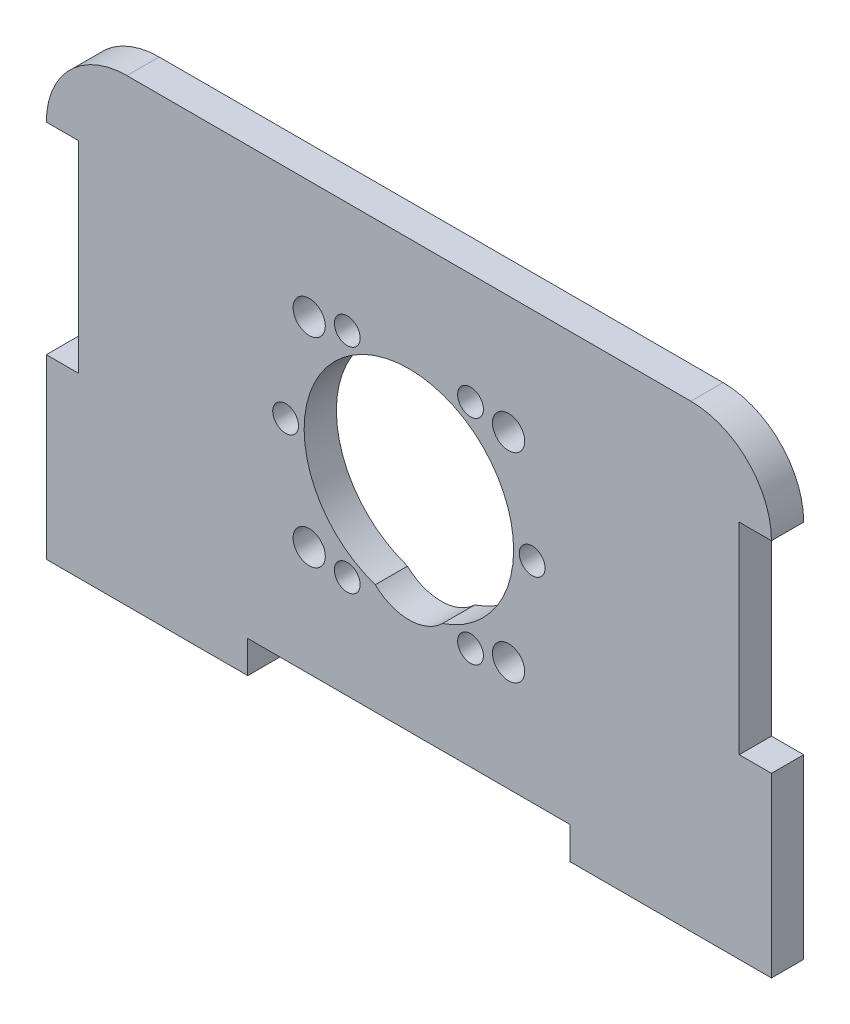
from build123d import *

# Parameters (mm, degrees)
SKETCH1_W           = 50
SKETCH1_H           = 4
BOSS_EXTRUDE1_DEPTH = 50
SKETCH2_R           = 13
CUT_EXTRUDE1_DEPTH  = 50
SKETCH4_R           = 2
CUT_EXTRUDE3_DEPTH  = 50
SKETCH7_W           = 4
SKETCH7_H           = 50
BOSS_EXTRUDE3_DEPTH = 20
SKETCH8_W           = 90
SKETCH8_H           = 4
BOSS_EXTRUDE4_DEPTH = 3
SKETCH9_W           = 25
SKETCH9_H           = 4
BOSS_EXTRUDE5_DEPTH = 4
FILLET1_R           = 10
SKETCH10_R          = 1.6
CUT_EXTRUDE4_DEPTH  = 20
CIRPATTERN1_COUNT   = 6
SKETCH11_R          = 6
CUT_EXTRUDE5_DEPTH  = 20
SKETCH12_W          = 4
SKETCH12_H          = 25
CUT_EXTRUDE6_DEPTH  = 20


with BuildPart() as part:
    # Sketch1 → Boss-Extrude1 (new body)
    with BuildSketch(Plane(origin=(0, 0, 0), x_dir=(1, 0, 0), z_dir=(0, 1, 0))):
        Rectangle(SKETCH1_W, SKETCH1_H)
    extrude(amount=BOSS_EXTRUDE1_DEPTH)

    # Sketch2 → Cut-Extrude1 (cut)
    with BuildSketch(Plane.XY.offset(2)):
        with Locations((0, 23)):
            Circle(SKETCH2_R)
    extrude(amount=-CUT_EXTRUDE1_DEPTH, mode=Mode.SUBTRACT)

    # Sketch4 → Cut-Extrude3 (cut)
    with BuildSketch(Plane.XY.offset(2)):
        with Locations((12.374368671, 35.374368671)):
            Circle(SKETCH4_R)
        with Locations((12.374368671, 10.625631329)):
            Circle(SKETCH4_R)
        with Locations((-12.374368671, 35.374368671)):
            Circle(SKETCH4_R)
        with Locations((-12.374368671, 10.625631329)):
            Circle(SKETCH4_R)
    extrude(amount=-CUT_EXTRUDE3_DEPTH, mode=Mode.SUBTRACT)

    # Sketch7 → Boss-Extrude3 (add)
    with BuildSketch(Plane.ZY.offset(25)):
        with Locations((0, 25)):
            Rectangle(SKETCH7_W, SKETCH7_H)
    boss_extrude3 = extrude(amount=BOSS_EXTRUDE3_DEPTH)

    # Mirror1: Boss-Extrude3 across plane
    add(boss_extrude3.mirror(Plane(origin=(0, 0, 0), x_dir=(0, 0, 1), z_dir=(1, 0, 0))))

    # Sketch8 → Boss-Extrude4 (add)
    with BuildSketch(Plane.XZ):
        Rectangle(SKETCH8_W, SKETCH8_H)
    extrude(amount=BOSS_EXTRUDE4_DEPTH)

    # Sketch9 → Boss-Extrude5 (add)
    with BuildSketch(Plane.XY.offset(2)):
        with Locations((-32.5, -5)):
            Rectangle(SKETCH9_W, SKETCH9_H)
        with Locations((32.5, -5)):
            Rectangle(SKETCH9_W, SKETCH9_H)
    extrude(amount=-BOSS_EXTRUDE5_DEPTH)

    # Fillet1
    fillet1_edges = [part.edges().sort_by_distance(p)[0] for p in [
        (-45, 50, 0),
        (45, 50, 0),
    ]]
    fillet(fillet1_edges, radius=FILLET1_R)

    # Sketch10 → Cut-Extrude4 (cut)
    with BuildSketch(Plane.XY.offset(2)):
        with Locations((-15.3, 23)):
            Circle(SKETCH10_R)
    cut_extrude4 = extrude(amount=-CUT_EXTRUDE4_DEPTH, mode=Mode.SUBTRACT)

    # CirPattern1: Cut-Extrude4 ×6 about axis
    cirpattern1_axis = Axis((0, 23, 0), (0, 0, 1))
    for i in range(1, CIRPATTERN1_COUNT):
        add(cut_extrude4.rotate(cirpattern1_axis, i * 360 / CIRPATTERN1_COUNT), mode=Mode.SUBTRACT)

    # Sketch11 → Cut-Extrude5 (cut)
    with BuildSketch(Plane.XY.offset(2)):
        with Locations((0, 15)):
            Circle(SKETCH11_R)
    extrude(amount=-CUT_EXTRUDE5_DEPTH, mode=Mode.SUBTRACT)

    # Sketch12 → Cut-Extrude6 (cut)
    with BuildSketch(Plane.XY.offset(2)):
        with Locations((43, 27.5)):
            Rectangle(SKETCH12_W, SKETCH12_H)
        with Locations((-43, 27.5)):
            Rectangle(SKETCH12_W, SKETCH12_H)
    extrude(amount=-CUT_EXTRUDE6_DEPTH, mode=Mode.SUBTRACT)


solid = part.part
